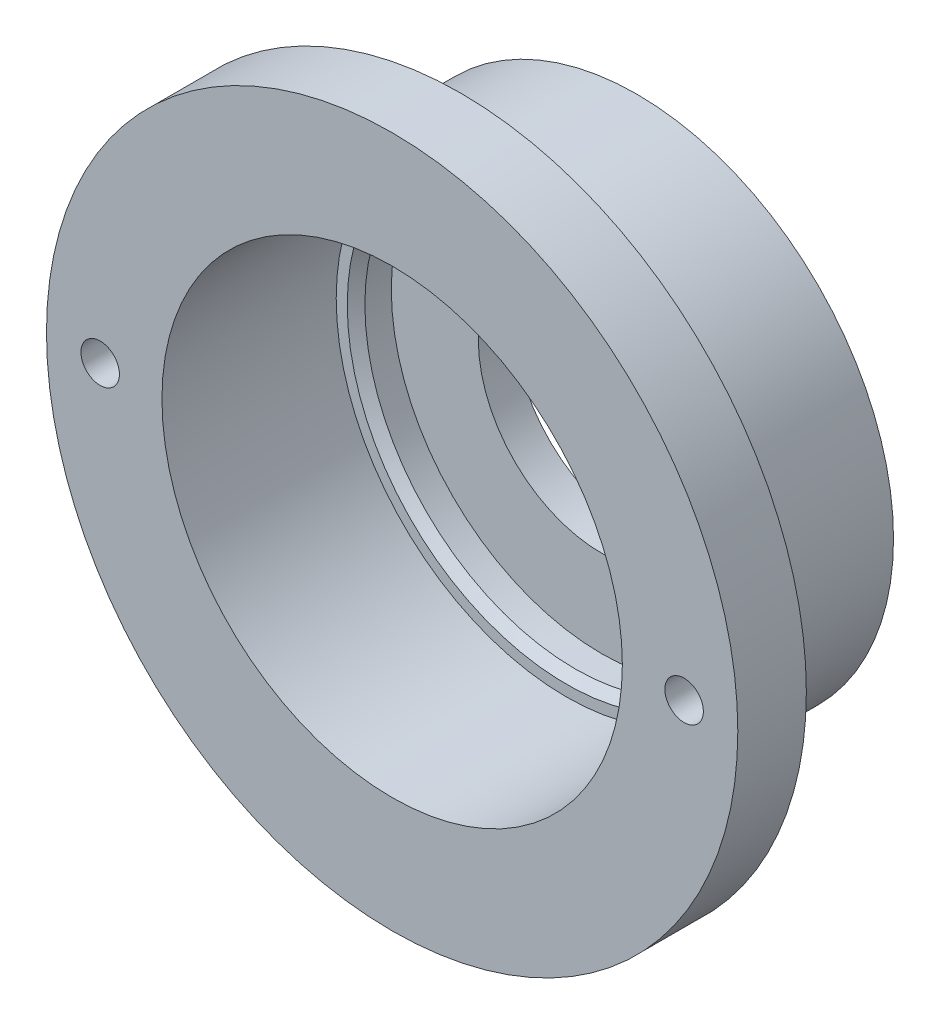
from build123d import *

# Parameters (mm, degrees)
SKETCH1_W          = 12.617819502
SKETCH1_H          = 2
SKETCH1_W_2        = 6.5532
SKETCH1_H_2        = 9.89
SKETCH2_R          = 26.652766262
SKETCH2_R_2        = 14.565
CUT_EXTRUDE1_DEPTH = 10
SKETCH4_R          = 1.0922
CUT_EXTRUDE2_DEPTH = 30.490976315
CHAMFER1_SIZE      = 0.5


with BuildPart() as part:
    # Sketch1 → Revolve1 (revolve)
    with BuildSketch(Plane(origin=(0, 0, 0), x_dir=(1, 0, 0), z_dir=(0, 1, 0))):
        with Locations((-13.308909751, 3.700473465)):
            Rectangle(SKETCH1_W, SKETCH1_H)
        Polygon((-11.938, 2.700473465), (-19.617819502, 2.700473465), (-19.617819502, 0.700473465), (-13.064619502, 0.700473465), (-11.938, 0.700473465), align=None)
        with Locations((-16.341219502, -4.244526535)):
            Rectangle(SKETCH1_W_2, SKETCH1_H_2)
    revolve(axis=Axis((0, 0, -25.411285606), (0, 0, 1)))

    # Sketch2 → Cut-Extrude1 (cut)
    with BuildSketch(Plane(origin=(0, 0, -4.700473465), x_dir=(-1, 0, 0), z_dir=(0, 0, -1))):
        Circle(SKETCH2_R)
        Circle(SKETCH2_R_2, mode=Mode.SUBTRACT)
    extrude(amount=-CUT_EXTRUDE1_DEPTH, mode=Mode.SUBTRACT)

    # Sketch4 → Cut-Extrude2 (cut, through all)
    with BuildSketch(Plane(origin=(0, 0, 5.299526535), x_dir=(-1, 0, 0), z_dir=(0, 0, -1))):
        with Locations((16.57, 0)):
            Circle(SKETCH4_R)
        with Locations(Location((-16.57, 0, 0), (0, 0, 180))):
            Circle(SKETCH4_R)
    extrude(amount=-CUT_EXTRUDE2_DEPTH, mode=Mode.SUBTRACT)

    # Chamfer1
    chamfer1_edges = [part.edges().sort_by_distance(p)[0] for p in [
        (11.938, 0, -0.700473465),
    ]]
    chamfer(chamfer1_edges, length=CHAMFER1_SIZE)


solid = part.part
